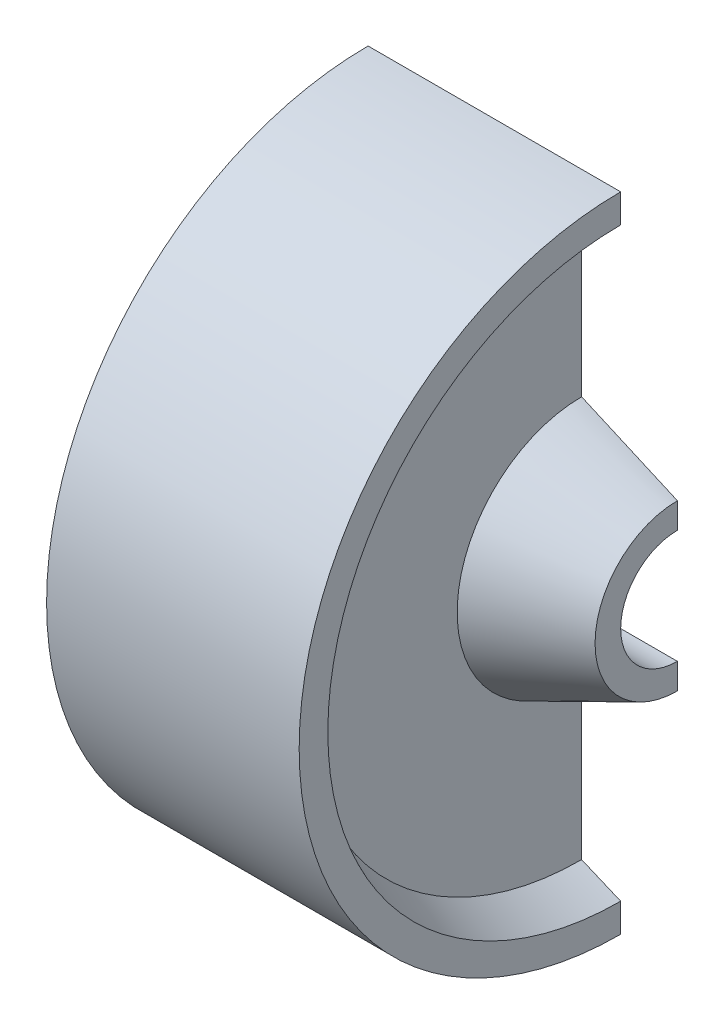
from build123d import *

# Parameters (mm, degrees)
REVOLVE_1_ANGLE = 180


with BuildPart() as part:
    # 草图1 → 旋转1 (revolve)
    with BuildSketch(Plane.XY):
        Polygon((-61.976468087, 19.212705107), (61.976468087, 19.212705107), (61.976468087, 27.889410639), (29.542116455, 42.143998299), (29.542116455, 93.584466811), (42.76376298, 99.162348939), (42.76376298, 108.871995605), (-42.76376298, 108.871995605), (-42.76376298, 99.162348939), (-29.542116455, 93.584466811), (-29.542116455, 42.143998299), (-61.976468087, 27.889410639), align=None)
    revolve(axis=Axis((0, 0, 0), (1, 0, 0)), revolution_arc=REVOLVE_1_ANGLE)


solid = part.part
